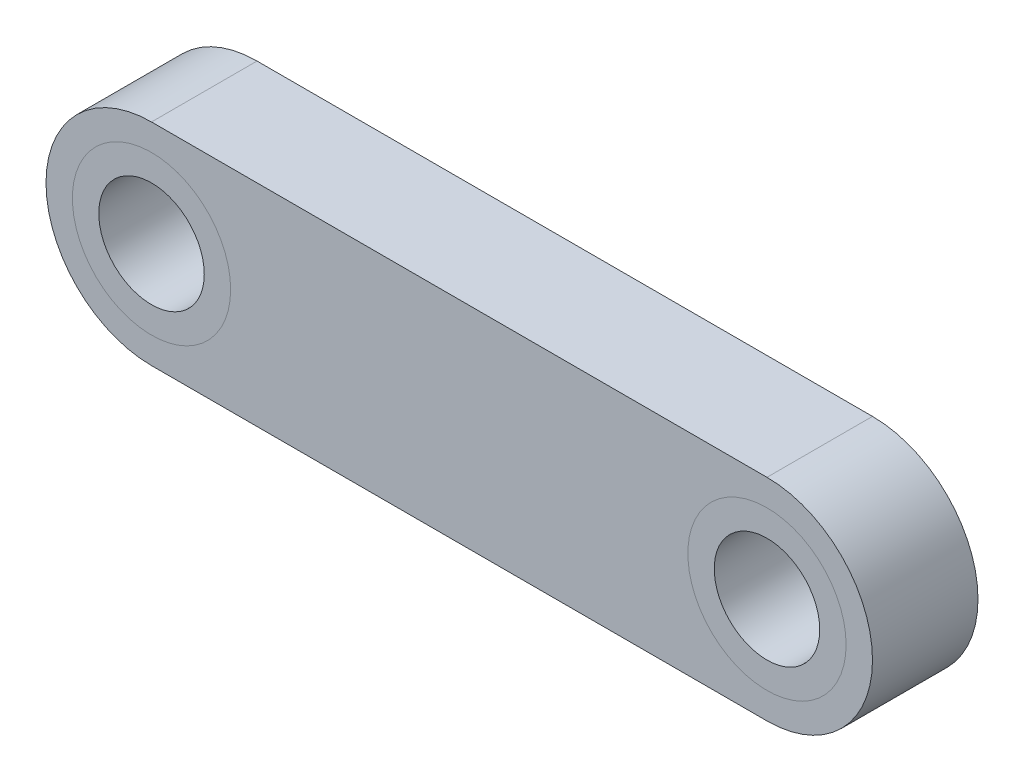
from build123d import *

# Parameters (mm, degrees)
SKETCH1_R             = 4.5
BOSS_EXTRUDE1_DEPTH   = 3
SKETCH1_3_R           = 4.5
SKETCH1_3_R_2         = 3
BOSS_EXTRUDE2_DEPTH   = 3
BOSS_EXTRUDE2_2_DEPTH = 3


with BuildPart() as part:
    # Sketch1 → Boss-Extrude1 (new, symmetric)
    with BuildSketch(Plane.XY):
        with BuildLine():
            Line((17.5, 6), (-17.5, 6))
            ThreePointArc((-17.5, 6), (-23.5, 0), (-17.5, -6))
            Line((-17.5, -6), (17.5, -6))
            ThreePointArc((17.5, -6), (23.5, 0), (17.5, 6))
        make_face()
        with Locations((-17.5, 0)):
            Circle(SKETCH1_R, mode=Mode.SUBTRACT)
        with Locations((17.5, 0)):
            Circle(SKETCH1_R, mode=Mode.SUBTRACT)
    extrude(amount=BOSS_EXTRUDE1_DEPTH, both=True)


with BuildPart() as body_2:
    # Sketch1<3> → Boss-Extrude2 (new, symmetric)
    with BuildSketch(Plane.XY):
        with Locations((-17.5, 0)):
            Circle(SKETCH1_3_R)
        with Locations((-17.5, 0)):
            Circle(SKETCH1_3_R_2, mode=Mode.SUBTRACT)
    extrude(amount=BOSS_EXTRUDE2_DEPTH, both=True)


with BuildPart() as body_3:
    # Sketch1<3> → Boss-Extrude2 2 (new, symmetric)
    with BuildSketch(Plane.XY):
        with Locations((17.5, 0)):
            Circle(SKETCH1_3_R)
        with Locations((17.5, 0)):
            Circle(SKETCH1_3_R_2, mode=Mode.SUBTRACT)
    extrude(amount=BOSS_EXTRUDE2_2_DEPTH, both=True)


solid = Compound([part.part, body_2.part, body_3.part])
